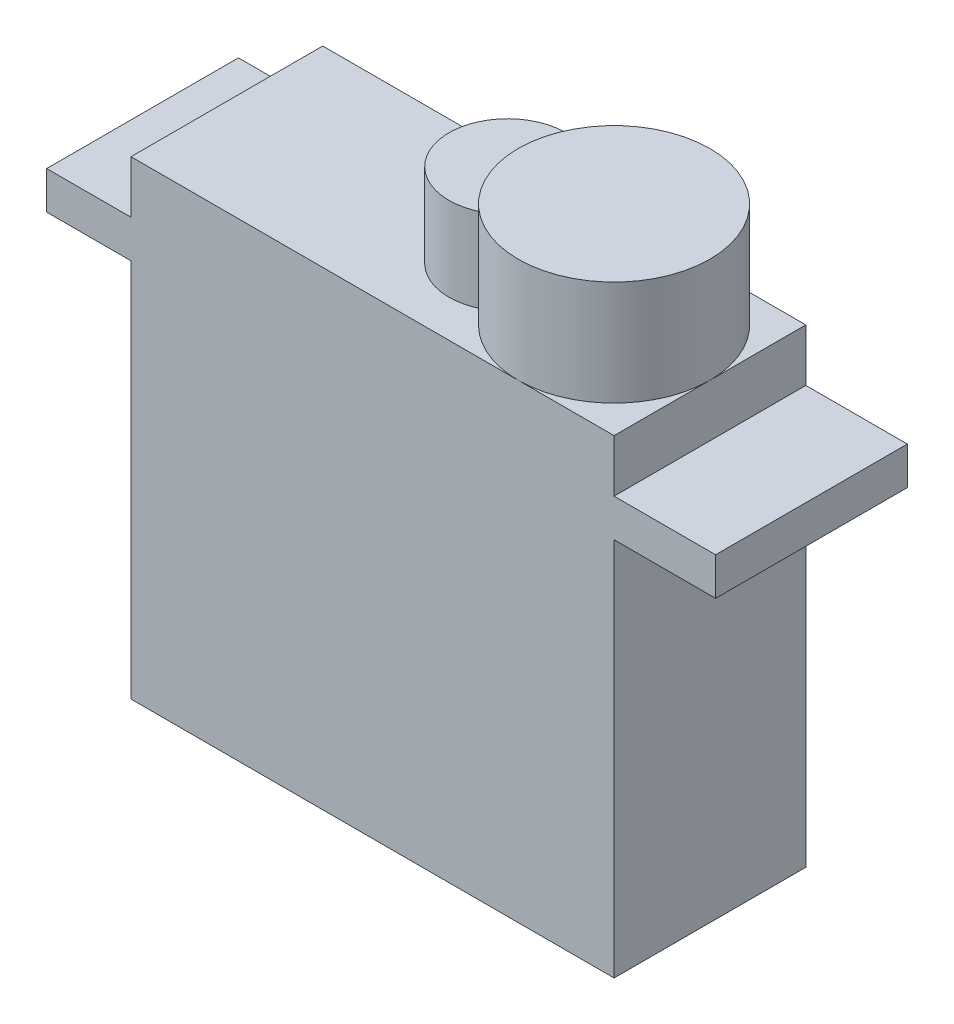
from build123d import *

# Parameters (mm, degrees)
SKETCH1_W           = 23.0378
SKETCH1_H           = 9.144
BOSS_EXTRUDE1_DEPTH = 18.1
SKETCH2_W           = 31.9
SKETCH2_H           = 9.144
BOSS_EXTRUDE2_DEPTH = 1.8
SKETCH3_W           = 23.0378
SKETCH3_H           = 9.144
BOSS_EXTRUDE3_DEPTH = 2.5
SKETCH4_R           = 4.572
BOSS_EXTRUDE4_DEPTH = 5
SKETCH5_R           = 2.794
BOSS_EXTRUDE5_DEPTH = 4


with BuildPart() as part:
    # Sketch1 → Boss-Extrude1 (new body)
    with BuildSketch(Plane(origin=(0, 0, 0), x_dir=(1, 0, 0), z_dir=(0, 1, 0))):
        with Locations((11.5189, 4.572)):
            Rectangle(SKETCH1_W, SKETCH1_H)
    extrude(amount=-BOSS_EXTRUDE1_DEPTH)

    # Sketch2 → Boss-Extrude2 (add)
    with BuildSketch(Plane(origin=(0, 0, 0), x_dir=(1, 0, 0), z_dir=(0, 1, 0))):
        with Locations((11.929019777, 4.572)):
            Rectangle(SKETCH2_W, SKETCH2_H)
    extrude(amount=BOSS_EXTRUDE2_DEPTH)

    # Sketch3 → Boss-Extrude3 (add)
    with BuildSketch(Plane(origin=(0, 1.8, 0), x_dir=(1, 0, 0), z_dir=(0, 1, 0))):
        with Locations((11.5189, 4.572)):
            Rectangle(SKETCH3_W, SKETCH3_H)
    extrude(amount=BOSS_EXTRUDE3_DEPTH)

    # Sketch4 → Boss-Extrude4 (add)
    with BuildSketch(Plane(origin=(0, 4.3, 0), x_dir=(1, 0, 0), z_dir=(0, 1, 0))):
        with Locations(Location((18.4658, 4.572, 0), (0, 0, 270))):
            Circle(SKETCH4_R)
    extrude(amount=BOSS_EXTRUDE4_DEPTH)

    # Sketch5 → Boss-Extrude5 (add)
    with BuildSketch(Plane(origin=(0, 4.3, 0), x_dir=(1, 0, 0), z_dir=(0, 1, 0))):
        with Locations((13.3858, 4.572)):
            Circle(SKETCH5_R)
    extrude(amount=BOSS_EXTRUDE5_DEPTH)


solid = part.part
